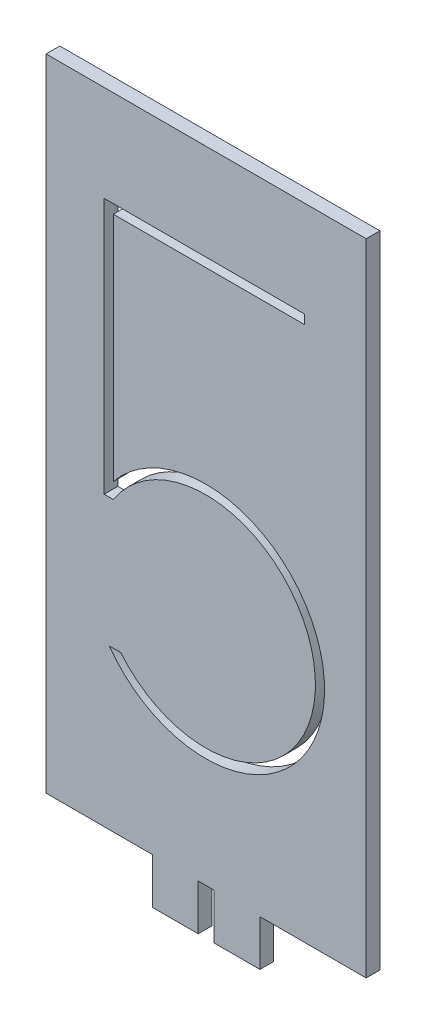
from build123d import *

# Parameters (mm, degrees)
SKIZZE1_W                       = 35
SKIZZE1_H                       = 75
AUFSATZ_LINEAR_AUSTRAGEN1_DEPTH = 1.5
SKIZZE2_W                       = 11.63
SKIZZE2_H                       = 5
SKIZZE2_W_2                     = 11.62
SKIZZE2_W_3                     = 1.75
SCHNITT_LINEAR_AUSTRAGEN1_DEPTH = 1.5
SCHNITT_LINEAR_AUSTRAGEN5_DEPTH = 20
SCHNITT_LINEAR_AUSTRAGEN6_DEPTH = 20


with BuildPart() as part:
    # Skizze1 → Aufsatz-Linear austragen1 (new body)
    with BuildSketch(Plane.XY):
        with Locations((17.5, 37.5)):
            Rectangle(SKIZZE1_W, SKIZZE1_H)
    extrude(amount=AUFSATZ_LINEAR_AUSTRAGEN1_DEPTH)

    # Skizze2 → Schnitt-Linear austragen1 (cut)
    with BuildSketch(Plane.XY.offset(1.5)):
        with Locations((5.815, 2.5)):
            Rectangle(SKIZZE2_W, SKIZZE2_H)
        with Locations((29.19, 2.5)):
            Rectangle(SKIZZE2_W_2, SKIZZE2_H)
        with Locations((17.505, 2.5)):
            Rectangle(SKIZZE2_W_3, SKIZZE2_H)
    extrude(amount=-SCHNITT_LINEAR_AUSTRAGEN1_DEPTH, mode=Mode.SUBTRACT)

    # Skizze10 → Schnitt-Linear austragen5 (cut)
    with BuildSketch(Plane.XY.offset(1.5)):
        with BuildLine():
            Line((7.35039959, 36.482684107), (6.35039959, 36.769688177))
            ThreePointArc((6.35039959, 36.769688177), (30.439070096, 30.49917213), (6.902625657, 22.398604162))
            Line((6.902625657, 22.398604162), (8.1632503, 22.398604162))
            ThreePointArc((8.1632503, 22.398604162), (29.428721451, 30.691419231), (7.35039959, 36.482684107))
        make_face()
    extrude(amount=-SCHNITT_LINEAR_AUSTRAGEN5_DEPTH, mode=Mode.SUBTRACT)

    # Skizze11 → Schnitt-Linear austragen6 (cut)
    with BuildSketch(Plane.XY.offset(1.5)):
        Polygon((7.35039959, 36.482684107), (6.35039959, 36.482684107), (6.35039959, 64.5), (7.35039959, 64.5), (28.25, 64.5), (28.25, 63.5), (7.35039959, 63.5), align=None)
    extrude(amount=-SCHNITT_LINEAR_AUSTRAGEN6_DEPTH, mode=Mode.SUBTRACT)


solid = part.part
